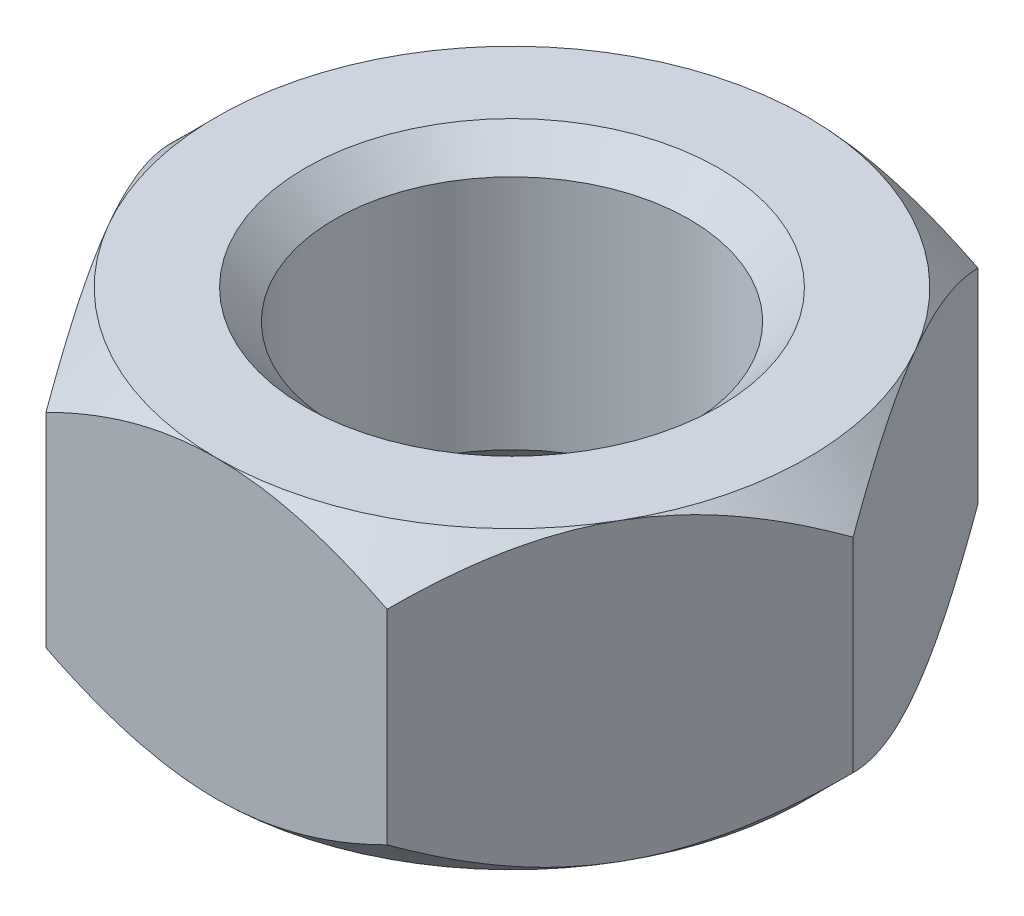
from build123d import *

# Parameters (mm, degrees)
SKETCH1_R           = 3
BOSS_EXTRUDE1_DEPTH = 5
CHAMFER1_SIZE       = 0.5


with BuildPart() as part:
    # Sketch1 → Boss-Extrude1 (new body)
    with BuildSketch(Plane(origin=(0, 0, 0), x_dir=(1, 0, 0), z_dir=(0, 1, 0))):
        Polygon((5.773502692, 0), (2.886751346, 5), (-2.886751346, 5), (-5.773502692, 0), (-2.886751346, -5), (2.886751346, -5), align=None)
        with Locations(Location((0, 0, 0), (0, 0, 270))):
            Circle(SKETCH1_R, mode=Mode.SUBTRACT)
    extrude(amount=BOSS_EXTRUDE1_DEPTH)

    # Sketch3 → Cut-Revolve1 (revolve, cut)
    with BuildSketch(Plane(origin=(0, 0, 0), x_dir=(0, 0, -1), z_dir=(1, 0, 0))):
        Polygon((-5, 0), (-6.5, 1.5), (-6.5, 0), align=None)
        Polygon((-6.5, 5), (-5, 5), (-6.5, 3.5), align=None)
    revolve(axis=Axis((0, 0, 0), (0, 1, 0)), mode=Mode.SUBTRACT)

    # Chamfer1
    chamfer1_edges = [part.edges().sort_by_distance(p)[0] for p in [
        (0, 0, -3),
        (0, 5, -3),
    ]]
    chamfer(chamfer1_edges, length=CHAMFER1_SIZE)


solid = part.part
